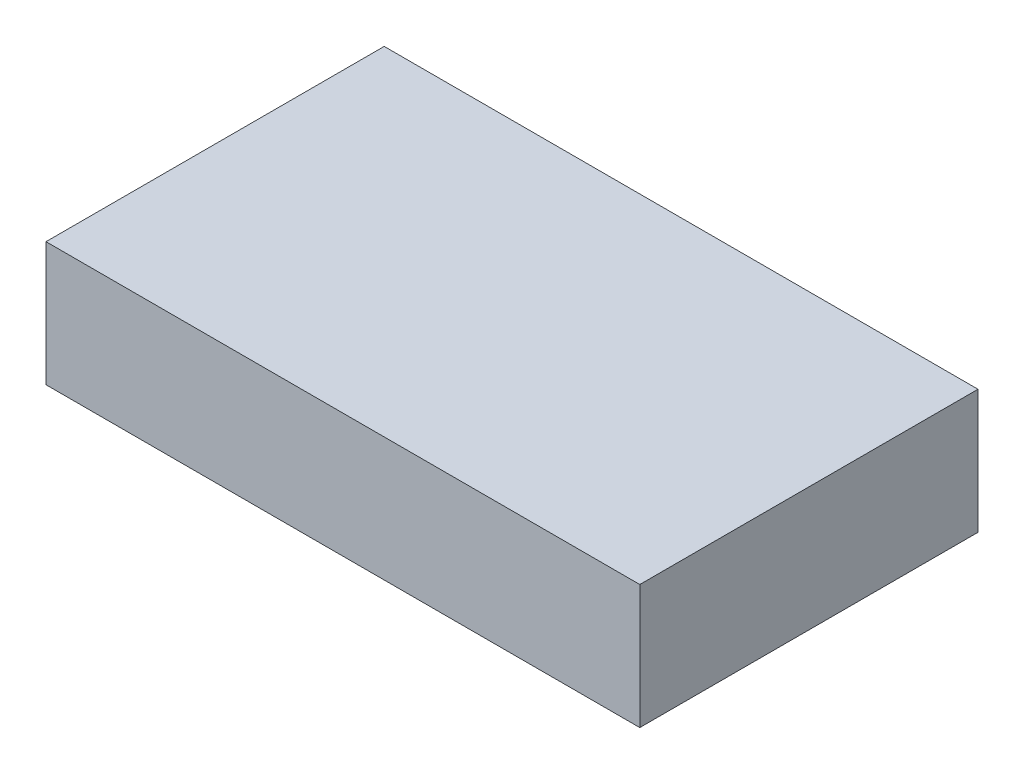
from build123d import *

# Parameters (mm, degrees)
CROQUIS2_W              = 115
CROQUIS2_H              = 65.5
SALIENTE_EXTRUIR1_DEPTH = 24


with BuildPart() as part:
    # Croquis2 → Saliente-Extruir1 (new body)
    with BuildSketch(Plane(origin=(0, 0, 0), x_dir=(1, 0, 0), z_dir=(0, 1, 0))):
        Rectangle(CROQUIS2_W, CROQUIS2_H)
    extrude(amount=SALIENTE_EXTRUIR1_DEPTH)


solid = part.part
